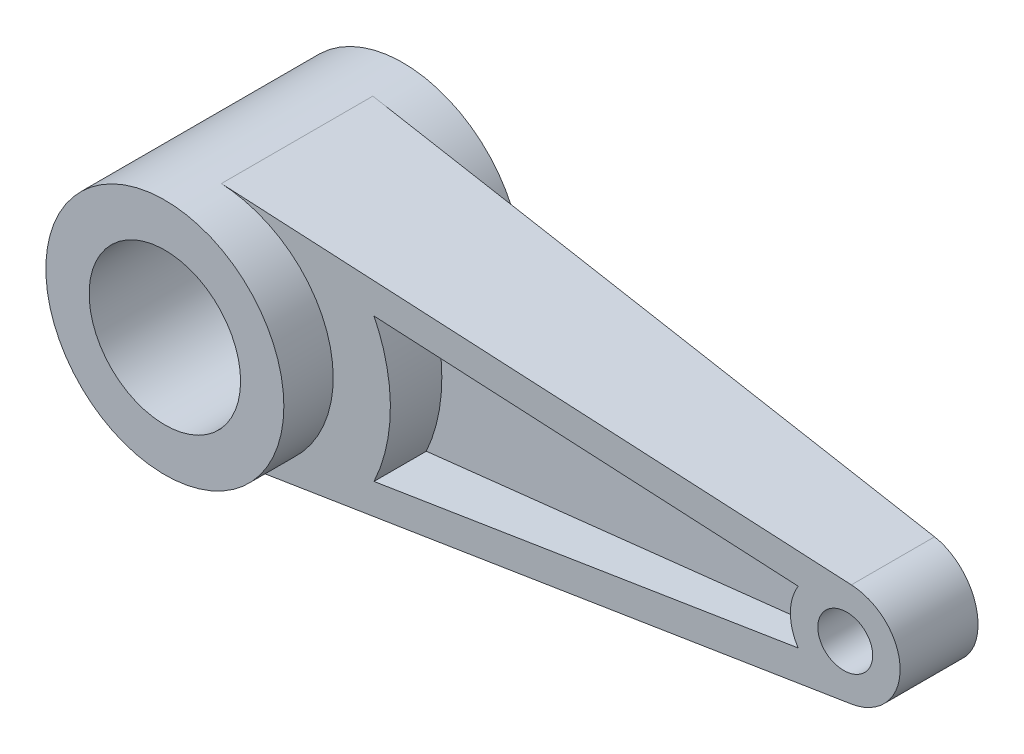
from build123d import *

# Parameters (mm, degrees)
BOSS_EXTRUDE1_DEPTH = 27.5
BOSS_EXTRUDE2_DEPTH = 17.5
CUT_EXTRUDE1_DEPTH  = 34
SKETCH3_R           = 17.5
SKETCH3_R_2         = 6
CUT_EXTRUDE2_DEPTH  = 34
CUT_EXTRUDE6_START  = 53
CUT_EXTRUDE6_DEPTH  = 53
SKETCH8_R           = 27.5
CUT_EXTRUDE7_DEPTH  = 47
SKETCH9_R           = 27.5
SKETCH9_R_2         = 17.5
BOSS_EXTRUDE3_DEPTH = 27.5


with BuildPart() as part:
    # Sketch1 → Boss-Extrude1 (new, symmetric)
    with BuildSketch(Plane.XY):
        with BuildLine():
            ThreePointArc((27.5, 0), (20.498019907, 18.332517009), (3.057732372, 27.329476262))
            ThreePointArc((3.057732372, 27.329476262), (-27.5, 0), (3.057732372, -27.329476262))
            ThreePointArc((3.057732372, -27.329476262), (20.498019907, -18.332517009), (27.5, 0))
        make_face()
    extrude(amount=BOSS_EXTRUDE1_DEPTH, both=True)

    # Sketch1<3> → Boss-Extrude2 (add, symmetric)
    with BuildSketch(Plane.XY):
        with BuildLine():
            Line((140.734972422, 11.925589642), (3.057732372, 27.329476262))
            ThreePointArc((3.057732372, 27.329476262), (27.5, 0), (3.057732372, -27.329476262))
            Line((3.057732372, -27.329476262), (140.734972422, -11.925589642))
            ThreePointArc((140.734972422, -11.925589642), (151.400689205, 0), (140.734972422, 11.925589642))
        make_face()
    extrude(amount=BOSS_EXTRUDE2_DEPTH, both=True)

    # Sketch2 → Cut-Extrude1 (cut, symmetric)
    with BuildSketch(Plane(origin=(0, 0, 0), x_dir=(1, 0, 0), z_dir=(0, 1, 0))):
        Polygon((3.057732372, 17.5), (151.400689205, 9), (151.400689205, 17.5), align=None)
        Polygon((151.400689205, -17.5), (151.400689205, -9), (3.057732372, -17.5), align=None)
    extrude(amount=CUT_EXTRUDE1_DEPTH, both=True, mode=Mode.SUBTRACT)

    # Sketch3 → Cut-Extrude2 (cut, symmetric)
    with BuildSketch(Plane.XY):
        Circle(SKETCH3_R)
        with Locations((139.400689205, 0)):
            Circle(SKETCH3_R_2)
    extrude(amount=CUT_EXTRUDE2_DEPTH, both=True, mode=Mode.SUBTRACT)

    # Sketch7 → Cut-Extrude6 (cut)
    with BuildSketch(Plane.XY.offset(3.5).offset(CUT_EXTRUDE6_START)):
        with BuildLine():
            Line((36.413905406, 16.553775796), (129.115571862, 6.181938308))
            ThreePointArc((129.115571862, 6.181938308), (127.400689205, 0), (129.115571862, -6.181938308))
            Line((129.115571862, -6.181938308), (36.413905406, -16.553775796))
            ThreePointArc((36.413905406, -16.553775796), (40, 0), (36.413905406, 16.553775796))
        make_face()
    cut_extrude6 = extrude(amount=-CUT_EXTRUDE6_DEPTH, mode=Mode.SUBTRACT)

    # Mirror2: Cut-Extrude6 across plane
    add(cut_extrude6.mirror(Plane.XY), mode=Mode.SUBTRACT)

    # Sketch8 → Cut-Extrude7 (cut, symmetric)
    with BuildSketch(Plane.XY):
        Circle(SKETCH8_R)
    extrude(amount=CUT_EXTRUDE7_DEPTH, both=True, mode=Mode.SUBTRACT)

    # Sketch9 → Boss-Extrude3 (add, symmetric)
    with BuildSketch(Plane.XY):
        Circle(SKETCH9_R)
        Circle(SKETCH9_R_2, mode=Mode.SUBTRACT)
    extrude(amount=BOSS_EXTRUDE3_DEPTH, both=True)


solid = part.part
